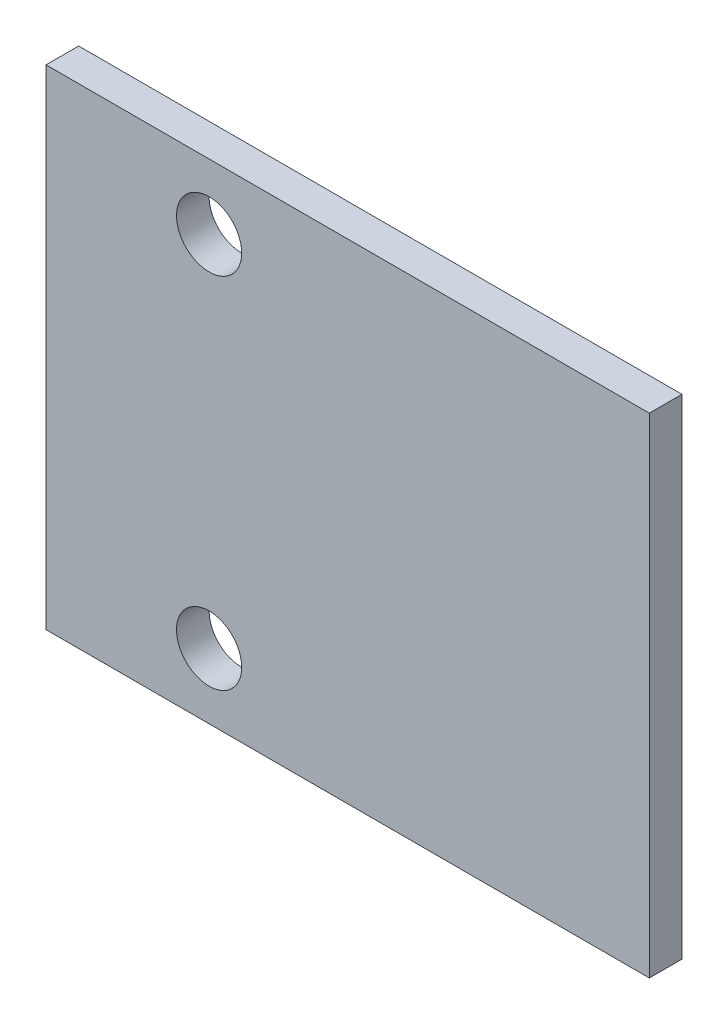
from build123d import *

# Parameters (mm, degrees)
PCB_W               = 18.5
PCB_H               = 15
PCB_R               = 1
BOSS_EXTRUDE1_DEPTH = 1


with BuildPart() as part:
    # PCB → Boss-Extrude1 (new body)
    with BuildSketch(Plane.XY):
        Rectangle(PCB_W, PCB_H)
        with Locations((-4.25, 5.5)):
            Circle(PCB_R, mode=Mode.SUBTRACT)
        with Locations((-4.25, -5.5)):
            Circle(PCB_R, mode=Mode.SUBTRACT)
    extrude(amount=BOSS_EXTRUDE1_DEPTH)


solid = part.part
